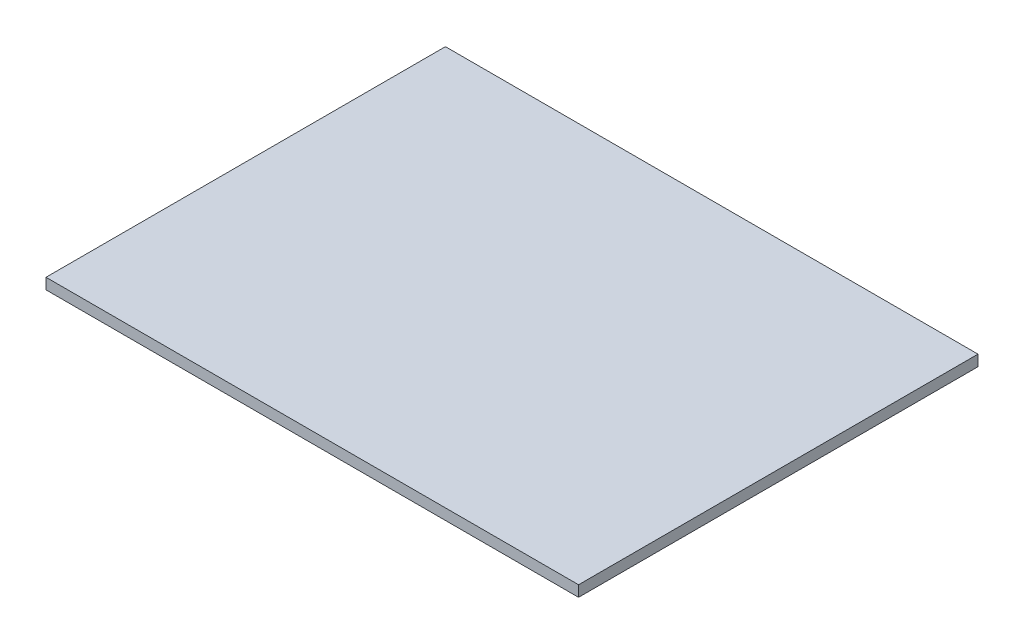
from build123d import *

# Parameters (mm, degrees)
SKETCH1_W           = 244
SKETCH1_H           = 183
BOSS_EXTRUDE1_DEPTH = 5


with BuildPart() as part:
    # Sketch1 → Boss-Extrude1 (new body)
    with BuildSketch(Plane(origin=(0, 0, 0), x_dir=(1, 0, 0), z_dir=(0, 1, 0))):
        Rectangle(SKETCH1_W, SKETCH1_H)
    extrude(amount=BOSS_EXTRUDE1_DEPTH)


solid = part.part
